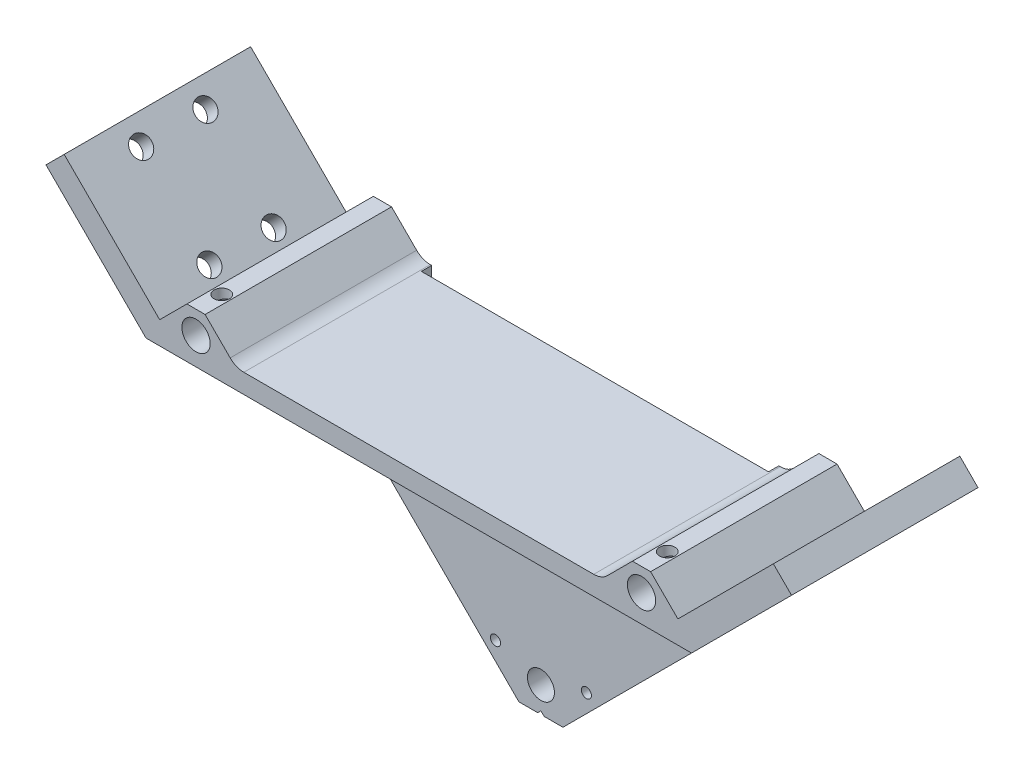
from build123d import *

# Parameters (mm, degrees)
MODEL_R             = 0.783493649
MODEL_R_2           = 2.1
MODEL_R_3           = 2.2
EXTRUDE_1_DEPTH     = 29
MODEL_3_R           = 0.783493649
CUT_EXTRUDE_1_DEPTH = 1.6
CUT_EXTRUDE_2_DEPTH = 19
MODEL_4_R           = 0.783493649
CUT_EXTRUDE_3_DEPTH = 14
CUT_EXTRUDE_4_DEPTH = 8.5
SKETCH_3_R          = 1.6
CUT_EXTRUDE_5_DEPTH = 20.5
SKETCH_4_R          = 1.2
CUT_EXTRUDE_6_DEPTH = 20.5
CHAMFER_1_SIZE      = 1.65


with BuildPart() as part:
    # Model → 凸台-拉伸1 (new body)
    with BuildSketch(Plane.XY):
        with BuildLine():
            Line((425.596900886, -54.208638654), (428.523307757, -54.208638654))
            Line((428.523307757, -54.208638654), (429.023307757, -53.708638654))
            Line((429.023307757, -53.708638654), (429.523307757, -54.208638654))
            Line((429.523307757, -54.208638654), (432.449714628, -54.208638654))
            Line((432.449714628, -54.208638654), (487.006063814, 0.347710533))
            Line((487.006063814, 0.347710533), (484.17763669, 3.176137657))
            Line((484.17763669, 3.176137657), (469.328394285, -11.673104748))
            Line((469.328394285, -11.673104748), (465.085753597, -7.43046406))
            Line((465.085753597, -7.43046406), (462.257326473, -7.43046406))
            Line((462.257326473, -7.43046406), (458.357831536, -11.329958997))
            ThreePointArc((458.357831536, -11.329958997), (457.38456149, -11.980277251), (456.236511192, -12.208638654))
            Line((456.236511192, -12.208638654), (401.810104322, -12.208638654))
            ThreePointArc((401.810104322, -12.208638654), (400.662054025, -11.980277251), (399.688783978, -11.329958997))
            Line((399.688783978, -11.329958997), (395.789289041, -7.43046406))
            Line((395.789289041, -7.43046406), (392.960861917, -7.43046406))
            Line((392.960861917, -7.43046406), (388.71822123, -11.673104748))
            Line((388.71822123, -11.673104748), (373.868978825, 3.176137657))
            Line((373.868978825, 3.176137657), (371.0405517, 0.347710533))
            Line((371.0405517, 0.347710533), (425.596900886, -54.208638654))
        make_face()
        with Locations((421.952239945, -47.735550588)):
            Circle(MODEL_R, mode=Mode.SUBTRACT)
        with Locations((436.094375569, -47.735550588)):
            Circle(MODEL_R, mode=Mode.SUBTRACT)
        with Locations((429.023307757, -50.208638654)):
            Circle(MODEL_R_2, mode=Mode.SUBTRACT)
        with Locations((394.375075479, -10.965997966)):
            Circle(MODEL_R_3, mode=Mode.SUBTRACT)
        with Locations((397.023307757, -20.208638654)):
            Circle(MODEL_R_2, mode=Mode.SUBTRACT)
        with Locations((461.023307757, -20.208638654)):
            Circle(MODEL_R_2, mode=Mode.SUBTRACT)
        with Locations((463.671540035, -10.965997966)):
            Circle(MODEL_R_3, mode=Mode.SUBTRACT)
    extrude(amount=EXTRUDE_1_DEPTH)

    # Model<3> → 切除-拉伸1 (cut)
    with BuildSketch(Plane.XY):
        with BuildLine():
            Line((427.550219692, -46.208638654), (430.496395822, -46.208638654))
            ThreePointArc((430.496395822, -46.208638654), (431.644446119, -46.437000056), (432.617716166, -47.08731831))
            Line((432.617716166, -47.08731831), (436.094375569, -50.563977713))
            Line((436.094375569, -50.563977713), (460.136006129, -26.522347153))
            Line((460.136006129, -26.522347152), (456.901987414, -23.288328437))
            ThreePointArc((456.901987414, -23.288328437), (456.25166916, -22.31505839), (456.023307757, -21.167008093))
            Line((456.023307757, -21.167008093), (456.023307757, -12.208638654))
            Line((456.023307757, -12.208638654), (402.023307757, -12.208638654))
            Line((402.023307757, -12.208638654), (402.023307757, -21.167008093))
            ThreePointArc((402.023307757, -21.167008093), (401.794946355, -22.31505839), (401.144628101, -23.288328437))
            Line((401.144628101, -23.288328437), (397.910609385, -26.522347152))
            Line((397.910609385, -26.522347153), (421.952239945, -50.563977713))
            Line((421.952239945, -50.563977713), (425.428899348, -47.08731831))
            ThreePointArc((425.428899348, -47.08731831), (426.402169395, -46.437000056), (427.550219692, -46.208638654))
        make_face()
        with Locations((421.952239945, -47.735550588)):
            Circle(MODEL_3_R, mode=Mode.SUBTRACT)
        with Locations((436.094375569, -47.735550588)):
            Circle(MODEL_3_R, mode=Mode.SUBTRACT)
    extrude(amount=CUT_EXTRUDE_1_DEPTH, mode=Mode.SUBTRACT)

    # 草图2 → 切除-拉伸2 (cut)
    with BuildSketch(Plane.XY.offset(29)):
        Polygon((376.157236436, -15.208638654), (485.70445639, -15.208638654), (432.449714628, -54.208638654), (404.679481101, -54.208638654), align=None)
    extrude(amount=-CUT_EXTRUDE_2_DEPTH, mode=Mode.SUBTRACT)

    # Model<4> → 切除-拉伸3 (cut)
    with BuildSketch(Plane.XY):
        with Locations((457.307579005, -26.522347153)):
            Circle(MODEL_4_R)
        with Locations((439.023307757, -13.708638654)):
            Circle(MODEL_4_R)
        with Locations((419.023307757, -13.708638654)):
            Circle(MODEL_4_R)
        with Locations((454.023307757, -13.708638654)):
            Circle(MODEL_4_R)
        with Locations((404.023307757, -13.708638654)):
            Circle(MODEL_4_R)
        with Locations((400.73903651, -26.522347153)):
            Circle(MODEL_4_R)
    extrude(amount=CUT_EXTRUDE_3_DEPTH, mode=Mode.SUBTRACT)

    # Model<5> → 切除-拉伸4 (cut)
    with BuildSketch(Plane.XY):
        with BuildLine():
            ThreePointArc((453.144628101, -29.271084494), (453.794946355, -28.297814447), (454.023307757, -27.14976415))
            Line((454.023307757, -27.14976415), (454.023307757, -18.208638654))
            ThreePointArc((454.023307757, -18.208638654), (453.144628101, -16.08731831), (451.023307757, -15.208638654))
            Line((451.023307757, -15.208638654), (407.023310678, -15.208638654))
            ThreePointArc((407.023310678, -15.208638654), (404.901988446, -16.087317277), (404.023307757, -18.208638654))
            Line((404.023307757, -18.208638654), (404.023307757, -27.14976415))
            ThreePointArc((404.023307757, -27.14976415), (404.2516662, -28.297807303), (404.901976478, -29.271073558))
            Line((404.901976478, -29.271073558), (419.960861917, -44.329958997))
            ThreePointArc((419.960861917, -44.329958997), (420.934131963, -44.980277251), (422.08218226, -45.208638654))
            Line((422.08218226, -45.208638654), (435.964433254, -45.208638654))
            ThreePointArc((435.964433254, -45.208638654), (437.112483551, -44.980277251), (438.085753597, -44.329958997))
            Line((438.085753597, -44.329958997), (453.144628101, -29.271084494))
        make_face()
    extrude(amount=CUT_EXTRUDE_4_DEPTH, mode=Mode.SUBTRACT)

    # 草图3 → 切除-拉伸5 (cut)
    with BuildSketch(Plane(origin=(185.694131116, 185.694131116, 0), x_dir=(0, 0, 1), z_dir=(-0.7071067811865468, -0.7071067811865482, 0))):
        with Locations((9.5, -265.619421727)):
            Circle(SKETCH_3_R)
        with Locations((9.5, -280.619421727)):
            Circle(SKETCH_3_R)
        with Locations((19.5, -265.619421727)):
            Circle(SKETCH_3_R)
        with Locations((19.5, -280.619421727)):
            Circle(SKETCH_3_R)
    cut_extrude_5 = extrude(amount=-CUT_EXTRUDE_5_DEPTH, mode=Mode.SUBTRACT)

    # 草图4 → 切除-拉伸6 (cut)
    with BuildSketch(Plane(origin=(0, -7.43046406, 0), x_dir=(1, 0, 0), z_dir=(0, 1, 0))):
        with Locations((394.375075479, -25)):
            Circle(SKETCH_4_R)
    cut_extrude_6 = extrude(amount=-CUT_EXTRUDE_6_DEPTH, mode=Mode.SUBTRACT)

    # 镜向5: 切除-拉伸5, 切除-拉伸6 across plane
    add(cut_extrude_5.mirror(Plane.ZY.offset(-429.023307757)), mode=Mode.SUBTRACT)
    add(cut_extrude_6.mirror(Plane.ZY.offset(-429.023307757)), mode=Mode.SUBTRACT)

    # 倒角1
    chamfer_1_edges = [part.edges().sort_by_distance(p)[0] for p in [
        (384.122027152, -12.733764919, 7.9),
        (384.122027152, -12.733764919, 17.9),
        (373.515425434, -2.127163202, 17.9),
        (373.515425434, -2.127163202, 7.9),
        (393.175075479, -15.208638654, 25),
        (473.924588363, -12.733764919, 17.9),
        (484.53119008, -2.127163202, 17.9),
        (484.53119008, -2.127163202, 7.9),
        (473.924588363, -12.733764919, 7.9),
        (464.871540035, -15.208638654, 25),
    ]]
    chamfer(chamfer_1_edges, length=CHAMFER_1_SIZE)


solid = part.part
